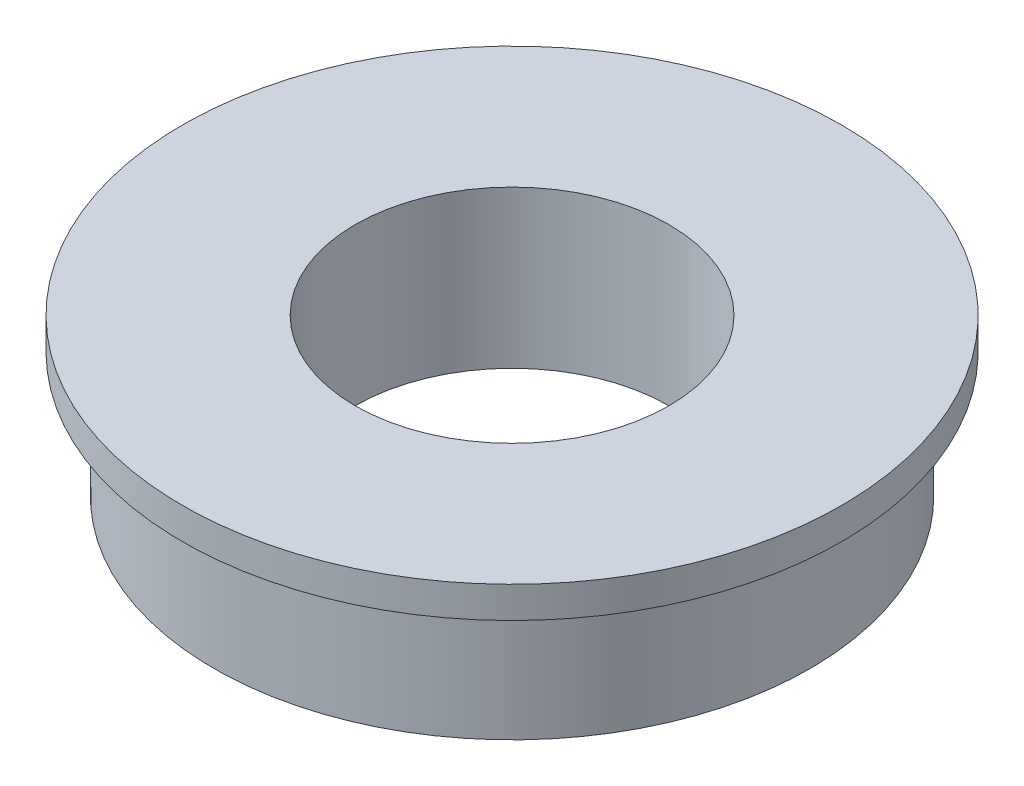
from build123d import *


with BuildPart() as part:
    # 草图2 → 旋转1 (revolve)
    with BuildSketch(Plane.XY, mode=Mode.PRIVATE) as revolve_1_sk:
        Polygon((-5, 0), (-9.5, 0), (-9.5, 4), (-10.5, 4), (-10.5, 5), (-5, 5), align=None)
    revolve(revolve_1_sk.sketch.rotate(Axis((0, 0, 0), (0, 1, 0)), 270), axis=Axis((0, 0, 0), (0, 1, 0)))


solid = part.part
